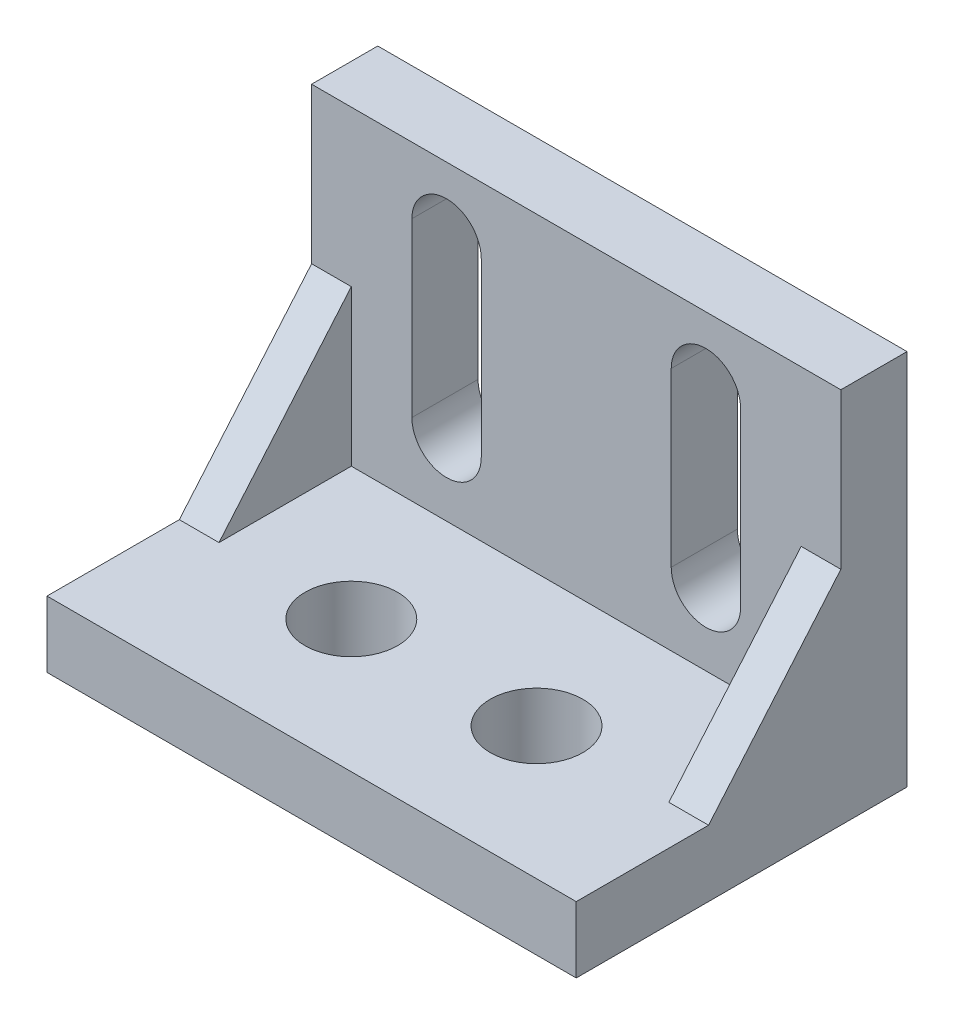
from build123d import *

# Parameters (mm, degrees)
SKETCH1_W           = 20
SKETCH1_H           = 14.251299249
BOSS_EXTRUDE1_DEPTH = 2.5
SKETCH2_W           = 20
SKETCH2_H           = 2.5
BOSS_EXTRUDE2_DEPTH = 10
BOSS_EXTRUDE5_DEPTH = 1.5
SKETCH4_R           = 1.75
CUT_EXTRUDE1_DEPTH  = 20.858072264


with BuildPart() as part:
    # Sketch1 → Boss-Extrude1 (new body)
    with BuildSketch(Plane.XY):
        with Locations((0, -3.814013666)):
            Rectangle(SKETCH1_W, SKETCH1_H)
        with BuildLine():
            Line((-6.210661491, -5.703500897), (-6.210661491, 0.803500897))
            ThreePointArc((-6.210661491, 0.803500897), (-4.9, 2.114162388), (-3.589338509, 0.803500897))
            Line((-3.589338509, 0.803500897), (-3.589338509, -5.703500897))
            ThreePointArc((-3.589338509, -5.703500897), (-4.9, -7.014162388), (-6.210661491, -5.703500897))
        make_face(mode=Mode.SUBTRACT)
        with BuildLine():
            Line((3.589338509, -5.703500897), (3.589338509, 0.803500897))
            ThreePointArc((3.589338509, 0.803500897), (4.9, 2.114162388), (6.210661491, 0.803500897))
            Line((6.210661491, 0.803500897), (6.210661491, -5.703500897))
            ThreePointArc((6.210661491, -5.703500897), (4.9, -7.014162388), (3.589338509, -5.703500897))
        make_face(mode=Mode.SUBTRACT)
    extrude(amount=BOSS_EXTRUDE1_DEPTH)

    # Sketch2 → Boss-Extrude2 (add)
    with BuildSketch(Plane.XY.offset(2.5)):
        with Locations((0, -9.68966329)):
            Rectangle(SKETCH2_W, SKETCH2_H)
    extrude(amount=BOSS_EXTRUDE2_DEPTH)

    # Sketch3 → Boss-Extrude5 (add)
    with BuildSketch(Plane(origin=(10, 0, 0), x_dir=(0, 0, -1), z_dir=(1, 0, 0))):
        Polygon((-7.5, -8.43966329), (-2.5, -2.564013666), (-2.5, -8.43966329), align=None)
    boss_extrude5 = extrude(amount=-BOSS_EXTRUDE5_DEPTH)

    # Sketch4 → Cut-Extrude1 (cut, through all)
    with BuildSketch(Plane(origin=(0, -8.43966329, 0), x_dir=(1, 0, 0), z_dir=(0, 1, 0))):
        with Locations(Location((3.5, -7.5, 0), (0, 0, 270))):
            Circle(SKETCH4_R)
    cut_extrude1 = extrude(amount=-CUT_EXTRUDE1_DEPTH, mode=Mode.SUBTRACT)

    # Mirror1: Boss-Extrude5, Cut-Extrude1 across plane
    add(boss_extrude5.mirror(Plane.ZY))
    add(cut_extrude1.mirror(Plane.ZY), mode=Mode.SUBTRACT)


solid = part.part
